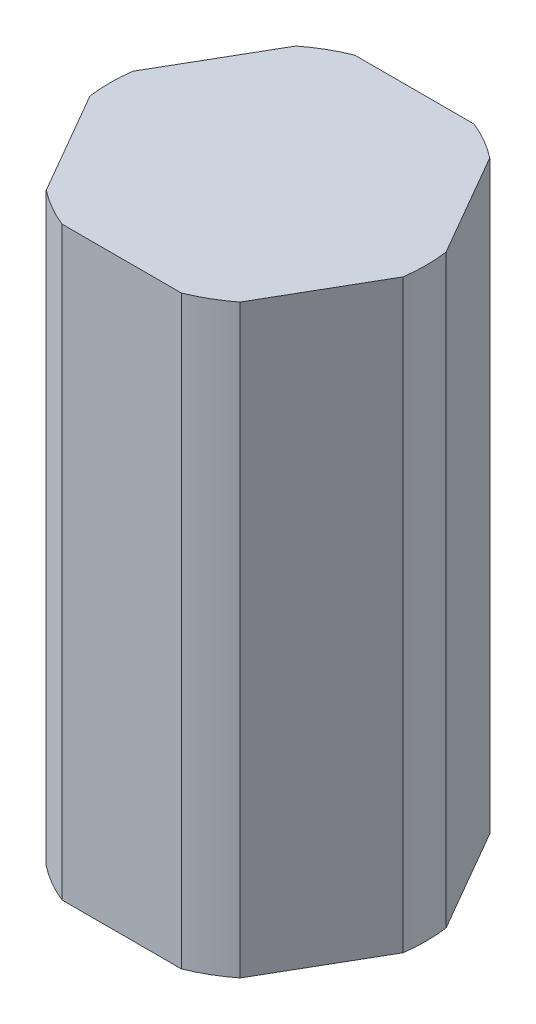
from build123d import *

# Parameters (mm, degrees)
BOSS_EXTRUDE1_DEPTH = 10


with BuildPart() as part:
    # Sketch1 → Boss-Extrude1 (new body)
    with BuildSketch(Plane(origin=(0, 0, 0), x_dir=(1, 0, 0), z_dir=(0, 1, 0))):
        with BuildLine():
            ThreePointArc((2.7, 0), (2.693734095, 0.183838592), (2.674965461, 0.366823913))
            Line((2.674965461, 0.366823913), (1.655161558, 2.133176087))
            ThreePointArc((1.655161558, 2.133176087), (1.35, 2.33826859), (1.019803903, 2.5))
            Line((1.019803903, 2.5), (-1.019803903, 2.5))
            ThreePointArc((-1.019803903, 2.5), (-1.35, 2.33826859), (-1.655161558, 2.133176087))
            Line((-1.655161558, 2.133176087), (-2.674965461, 0.366823913))
            ThreePointArc((-2.674965461, 0.366823913), (-2.7, 0), (-2.674965461, -0.366823913))
            Line((-2.674965461, -0.366823913), (-1.655161558, -2.133176087))
            ThreePointArc((-1.655161558, -2.133176087), (-1.35, -2.33826859), (-1.019803903, -2.5))
            Line((-1.019803903, -2.5), (1.019803903, -2.5))
            ThreePointArc((1.019803903, -2.5), (1.35, -2.33826859), (1.655161558, -2.133176087))
            Line((1.655161558, -2.133176087), (2.674965461, -0.366823913))
            ThreePointArc((2.674965461, -0.366823913), (2.693734095, -0.183838592), (2.7, 0))
        make_face()
    extrude(amount=BOSS_EXTRUDE1_DEPTH)


solid = part.part
